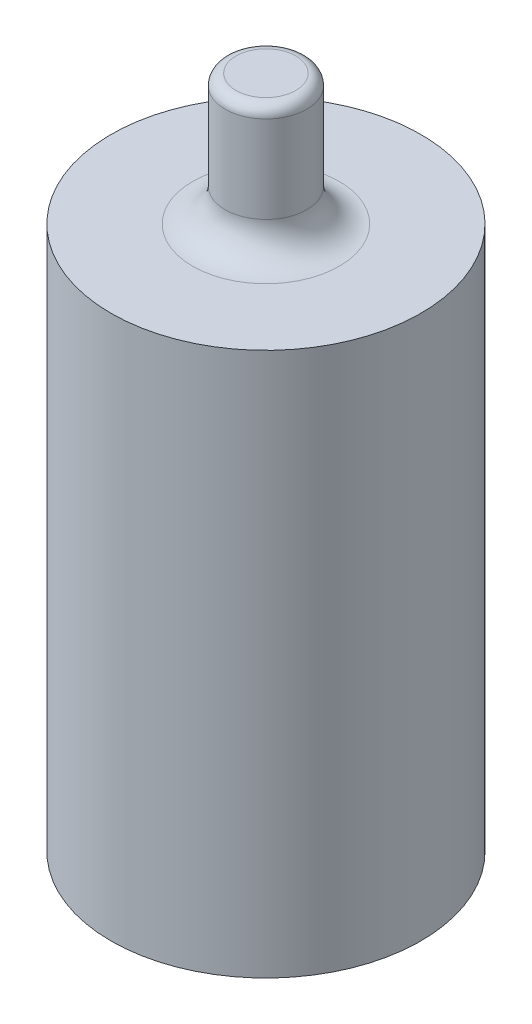
from build123d import *

# Parameters (mm, degrees)
IZIM3_R                     = 14.25
Y_KSEKLIK_EKSTR_ZYON2_DEPTH = 50
IZIM4_R                     = 3.75
Y_KSEKLIK_EKSTR_ZYON3_DEPTH = 12
RADYUS1_R                   = 3
RADYUS2_R                   = 1
IZIM5_R                     = 12.635430767
KES_EKSTR_ZYON1_DEPTH       = 47


with BuildPart() as part:
    # Çizim3 → Yükseklik-Ekstrüzyon2 (new body)
    with BuildSketch(Plane(origin=(0, 0, 0), x_dir=(1, 0, 0), z_dir=(0, 1, 0))):
        with Locations(Location((0, 0, 0), (0, 0, 270))):
            Circle(IZIM3_R)
    extrude(amount=Y_KSEKLIK_EKSTR_ZYON2_DEPTH)

    # Çizim4 → Yükseklik-Ekstrüzyon3 (add)
    with BuildSketch(Plane(origin=(0, 50, 0), x_dir=(1, 0, 0), z_dir=(0, 1, 0))):
        with Locations(Location((0, 0, 0), (0, 0, 270))):
            Circle(IZIM4_R)
    extrude(amount=Y_KSEKLIK_EKSTR_ZYON3_DEPTH)

    # Radyus1
    radyus1_edges = [part.edges().sort_by_distance(p)[0] for p in [
        (0, 50, -3.75),
    ]]
    fillet(radyus1_edges, radius=RADYUS1_R)

    # Radyus2
    radyus2_edges = [part.edges().sort_by_distance(p)[0] for p in [
        (0, 62, -3.75),
    ]]
    fillet(radyus2_edges, radius=RADYUS2_R)

    # Çizim5 → Kes-Ekstrüzyon1 (cut)
    with BuildSketch(Plane.XZ):
        with Locations(Location((0, 0, 0), (0, 0, 270))):
            Circle(IZIM5_R)
    extrude(amount=-KES_EKSTR_ZYON1_DEPTH, mode=Mode.SUBTRACT)


solid = part.part
